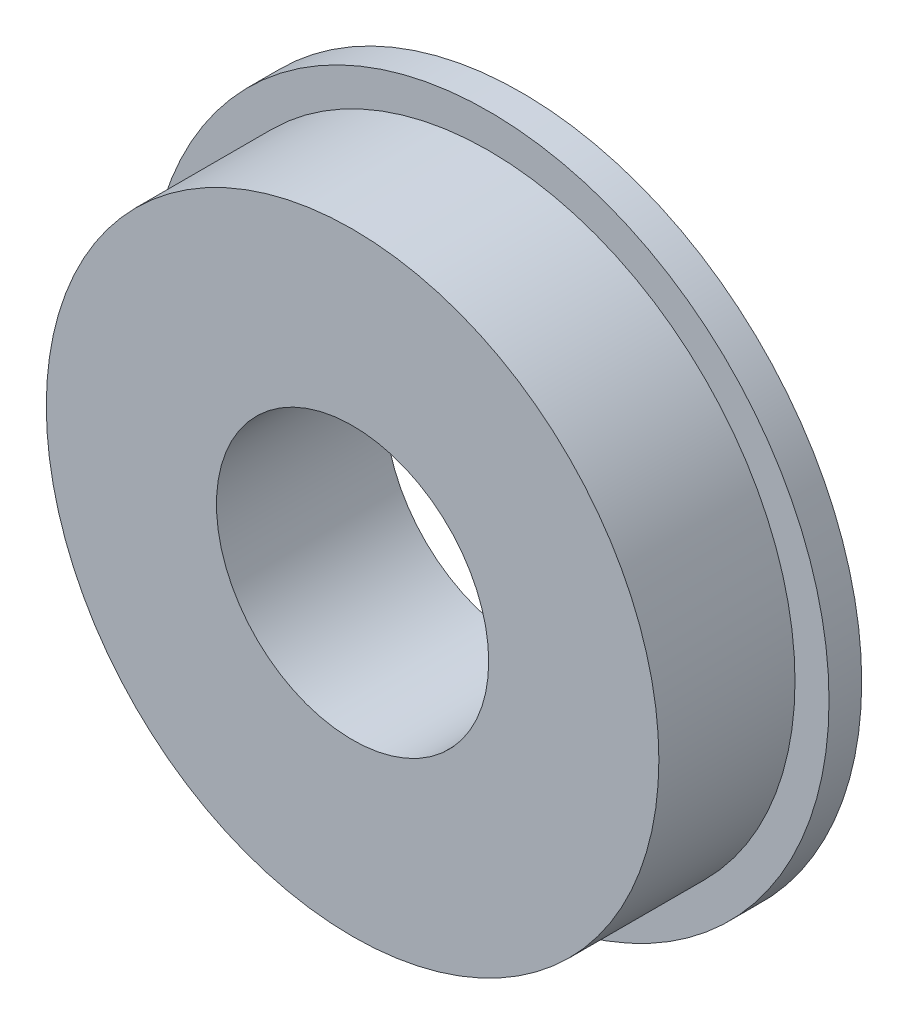
from build123d import *


with BuildPart() as part:
    # Sketch3 → Revolve1 (revolve)
    with BuildSketch(Plane(origin=(0, 0, 0), x_dir=(0, 0, -1), z_dir=(1, 0, 0)), mode=Mode.PRIVATE) as revolve1_sk:
        Polygon((0, 0.25), (0, 0.5625), (0.25, 0.5625), (0.25, 0.625), (0.31, 0.625), (0.31, 0.25), align=None)
    revolve(revolve1_sk.sketch.rotate(Axis((0, 0, 1000), (0, 0, -1)), 90), axis=Axis((0, 0, 1000), (0, 0, -1)))


solid = part.part
